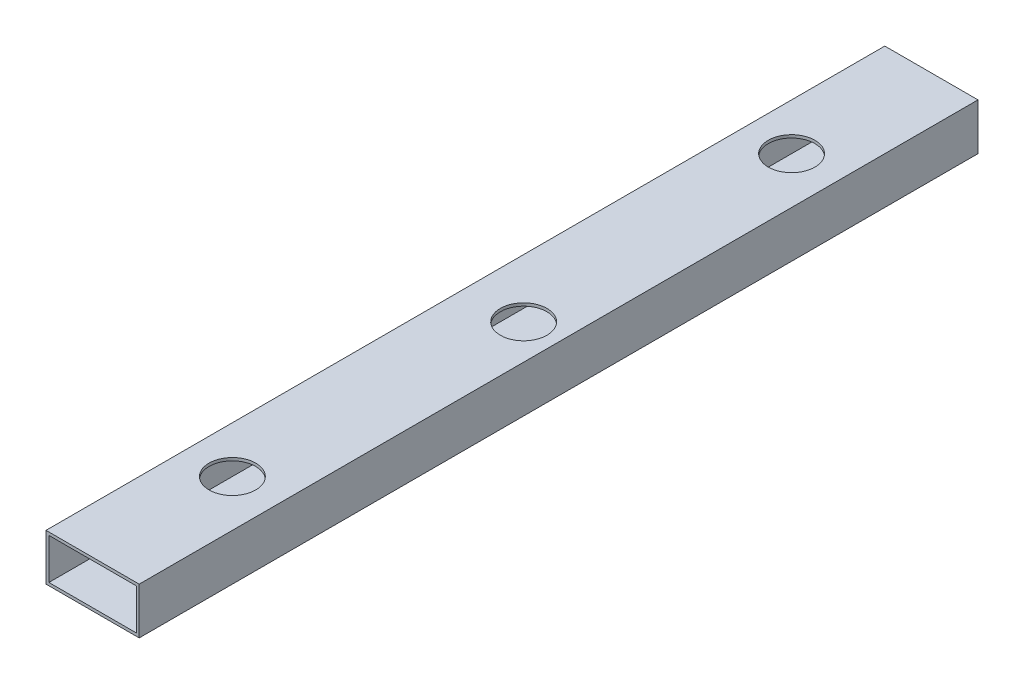
from build123d import *

# Parameters (mm, degrees)
SKETCH1_W           = 50.8
SKETCH1_H           = 25.4
SKETCH1_W_2         = 47.625
SKETCH1_H_2         = 22.225
BOSS_EXTRUDE1_DEPTH = 457.2
SKETCH2_R           = 12.7
CUT_EXTRUDE1_DEPTH  = 25.4
SKETCH4_R           = 12.7
CUT_EXTRUDE2_DEPTH  = 25.4
SKETCH5_R           = 12.7
CUT_EXTRUDE5_DEPTH  = 25.4


with BuildPart() as part:
    # Sketch1 → Boss-Extrude1 (new body)
    with BuildSketch(Plane.XY):
        with Locations((25.4, 12.7)):
            Rectangle(SKETCH1_W, SKETCH1_H)
        with Locations((25.4, 12.7)):
            Rectangle(SKETCH1_W_2, SKETCH1_H_2, mode=Mode.SUBTRACT)
    extrude(amount=BOSS_EXTRUDE1_DEPTH)

    # Sketch2 → Cut-Extrude1 (cut)
    with BuildSketch(Plane(origin=(0, 25.4, 0), x_dir=(1, 0, 0), z_dir=(0, 1, 0))):
        with Locations(Location((25.4, -381, 0), (0, 0, 270))):
            Circle(SKETCH2_R)
    extrude(amount=-CUT_EXTRUDE1_DEPTH, mode=Mode.SUBTRACT)

    # Sketch4 → Cut-Extrude2 (cut)
    with BuildSketch(Plane(origin=(0, 25.4, 0), x_dir=(1, 0, 0), z_dir=(0, 1, 0))):
        with Locations(Location((25.4, -76.2, 0), (0, 0, 270))):
            Circle(SKETCH4_R)
    extrude(amount=-CUT_EXTRUDE2_DEPTH, mode=Mode.SUBTRACT)

    # Sketch5 → Cut-Extrude5 (cut)
    with BuildSketch(Plane(origin=(0, 25.4, 0), x_dir=(1, 0, 0), z_dir=(0, 1, 0))):
        with Locations(Location((31.75, -228.6, 0), (0, 0, 270))):
            Circle(SKETCH5_R)
    extrude(amount=-CUT_EXTRUDE5_DEPTH, mode=Mode.SUBTRACT)


solid = part.part
